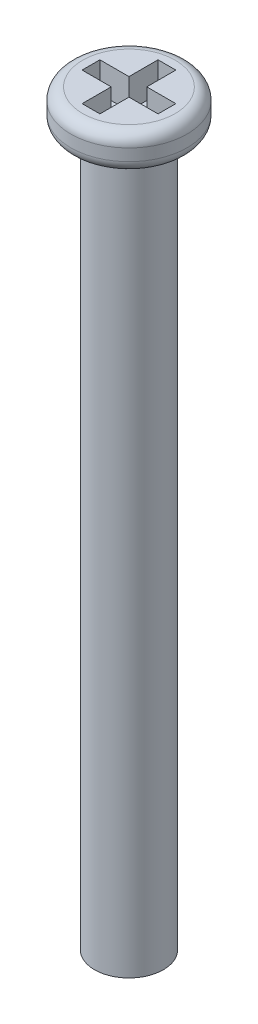
from build123d import *

# Parameters (mm, degrees)
SKETCH1_R           = 1.45
BOSS_EXTRUDE1_DEPTH = 30
SKETCH2_R           = 2.45
BOSS_EXTRUDE2_DEPTH = 1.5
FILLET1_R           = 0.5
SKETCH3_W           = 0.75
SKETCH3_H           = 1.225
SKETCH3_H_2         = 0.75
SKETCH3_W_2         = 1.225
CUT_EXTRUDE1_DEPTH  = 1.25
FILLET4_R           = 0.5


with BuildPart() as part:
    # Sketch1 → Boss-Extrude1 (new body)
    with BuildSketch(Plane(origin=(0, 0, 0), x_dir=(1, 0, 0), z_dir=(0, 1, 0))):
        with Locations(Location((0, 0, 0), (0, 0, 270))):
            Circle(SKETCH1_R)
    extrude(amount=BOSS_EXTRUDE1_DEPTH)

    # Sketch2 → Boss-Extrude2 (add)
    with BuildSketch(Plane(origin=(0, 30, 0), x_dir=(1, 0, 0), z_dir=(0, 1, 0))):
        with Locations(Location((0, 0, 0), (0, 0, 270))):
            Circle(SKETCH2_R)
    extrude(amount=BOSS_EXTRUDE2_DEPTH)

    # Fillet1
    fillet1_edges = [part.edges().sort_by_distance(p)[0] for p in [
        (0, 30, -2.45),
        (0, 31.5, -2.45),
    ]]
    fillet(fillet1_edges, radius=FILLET1_R)

    # Sketch3 → Cut-Extrude1 (cut)
    with BuildSketch(Plane(origin=(0, 31.5, 0), x_dir=(1, 0, 0), z_dir=(0, 1, 0))):
        with Locations((0, 0.9875)):
            Rectangle(SKETCH3_W, SKETCH3_H)
        Rectangle(SKETCH3_W, SKETCH3_H_2)
        with Locations((0, -0.9875)):
            Rectangle(SKETCH3_W, SKETCH3_H)
        with Locations((0.9875, 0)):
            Rectangle(SKETCH3_W_2, SKETCH3_H_2)
        with Locations((-0.9875, 0)):
            Rectangle(SKETCH3_W_2, SKETCH3_H_2)
    extrude(amount=-CUT_EXTRUDE1_DEPTH, mode=Mode.SUBTRACT)

    # Fillet4
    fillet4_edges = [part.edges().sort_by_distance(p)[0] for p in [
        (0, 30.25, 1.6),
        (-1.6, 30.25, 0),
        (0, 30.25, -1.6),
        (1.6, 30.25, 0),
    ]]
    fillet(fillet4_edges, radius=FILLET4_R)


solid = part.part
